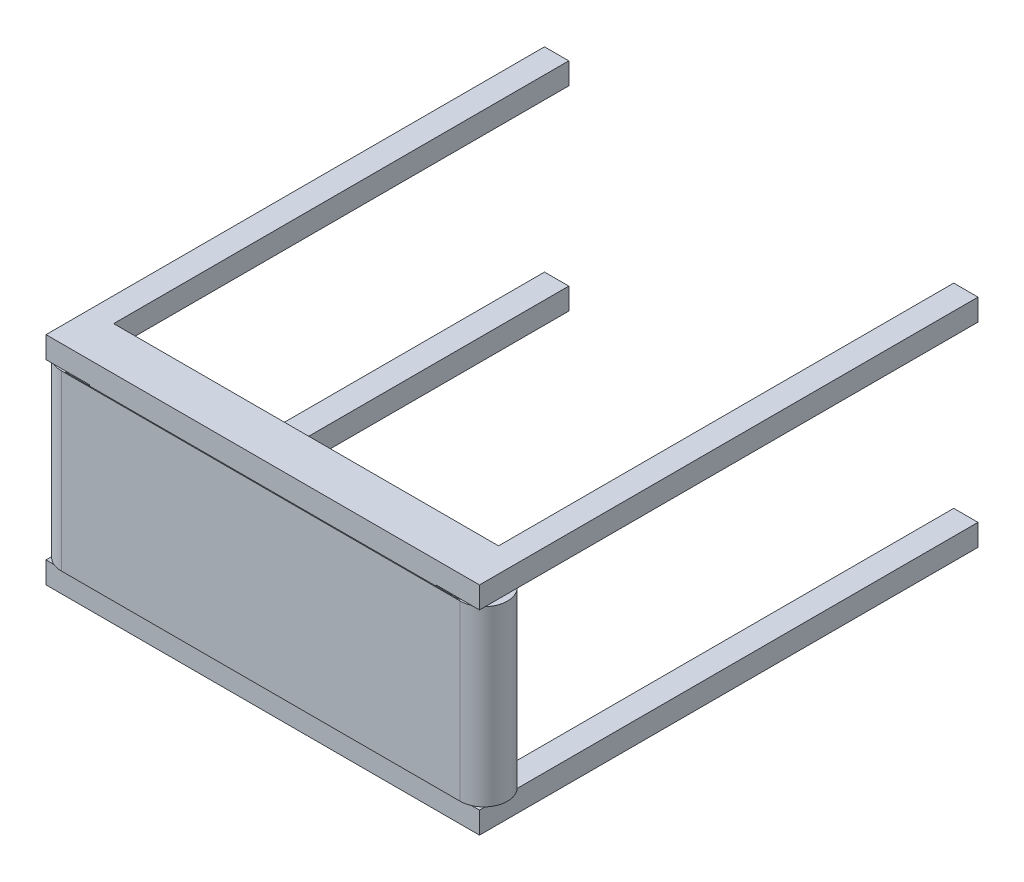
from build123d import *

# Parameters (mm, degrees)
BOSS_EXTRUDE1_DEPTH = 100
SKETCH2_R           = 52.5
BOSS_EXTRUDE2_DEPTH = 400
BOSS_EXTRUDE3_START = -400
BOSS_EXTRUDE3_DEPTH = 400
SKETCH4_W           = 56.007810594
SKETCH4_H           = 50
BOSS_EXTRUDE4_DEPTH = 1050


with BuildPart() as part:
    # Sketch1 → Boss-Extrude1 (new body)
    with BuildSketch(Plane.XY):
        Polygon((-500, 200), (-400, 200), (-400, -200), (-500, -200), (-500, -250), (500, -250), (500, -200), (400, -200), (400, 200), (500, 200), (500, 250), (-500, 250), align=None)
    extrude(amount=BOSS_EXTRUDE1_DEPTH)

    # Sketch2 → Boss-Extrude2 (add)
    with BuildSketch(Plane.XZ.offset(-200)):
        with Locations(Location((460, 50, 0), (0, 0, 107.752790162))):
            Circle(SKETCH2_R)
    boss_extrude2 = extrude(amount=BOSS_EXTRUDE2_DEPTH)

    # Mirror1: Boss-Extrude2 across plane
    add(boss_extrude2.mirror(Plane(origin=(0, 0, 0), x_dir=(0, 0, 1), z_dir=(1, 0, 0))))

    # Sketch3 → Boss-Extrude3 (add)
    with BuildSketch(Plane.XZ.offset(200).offset(BOSS_EXTRUDE3_START)):
        with BuildLine():
            Line((459.949680283, -4.49997677), (-514.179099401, 44.094478165))
            ThreePointArc((-514.179099401, 44.094478165), (-500.571547543, 86.389552484), (-460, 104.5))
            Line((-460, 104.5), (460, 104.5))
            ThreePointArc((460, 104.5), (514.499994192, 49.974840139), (459.949680283, -4.49997677))
        make_face()
        with BuildLine():
            Line((-460, 102.5), (460, 102.5))
            ThreePointArc((460, 102.5), (512.5, 50), (460, -2.5))
            Line((460, -2.5), (-512.347825784, 46.005611975))
            ThreePointArc((-512.347825784, 46.005611975), (-498.509449303, 85.682941504), (-460, 102.5))
        make_face(mode=Mode.SUBTRACT)
    extrude(amount=BOSS_EXTRUDE3_DEPTH)

    # Sketch4 → Boss-Extrude4 (add)
    with BuildSketch(Plane(origin=(0, 0, 0), x_dir=(-1, 0, 0), z_dir=(0, 0, -1))):
        with Locations((-471.996094703, 225)):
            Rectangle(SKETCH4_W, SKETCH4_H)
        with Locations((471.996094703, 225)):
            Rectangle(SKETCH4_W, SKETCH4_H)
        with Locations((471.996094703, -225)):
            Rectangle(SKETCH4_W, SKETCH4_H)
        with Locations((-471.996094703, -225)):
            Rectangle(SKETCH4_W, SKETCH4_H)
    extrude(amount=BOSS_EXTRUDE4_DEPTH)


solid = part.part
